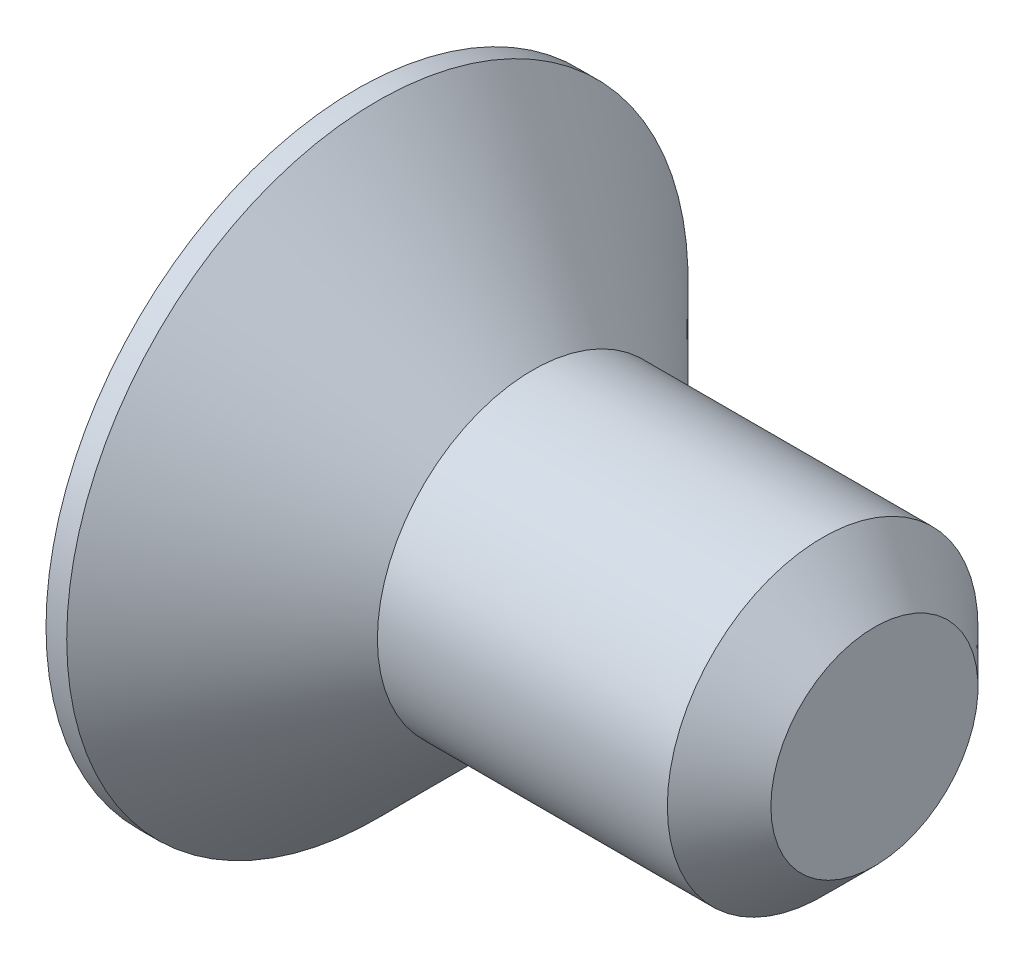
from build123d import *

# Parameters (mm, degrees)
CUT_EXTRUDE1_DEPTH = 1.1


with BuildPart() as part:
    # Sketch1 → Revolve1 (revolve)
    with BuildSketch(Plane.XY, mode=Mode.PRIVATE) as revolve1_sk:
        Polygon((0, -1.5), (2.8, -1.5), (3.3, -1), (3.3, 0), (-1.7, 0), (-1.7, -3), (-1.5, -3), align=None)
    revolve(revolve1_sk.sketch.rotate(Axis((-1.7, 0, 0), (1, 0, 0)), 270), axis=Axis((-1.7, 0, 0), (1, 0, 0)))

    # Sketch2 → Cut-Extrude1 (cut)
    with BuildSketch(Plane.ZY.offset(1.7)):
        Polygon((0, 1.154700538), (-1, 0.577350269), (-1, -0.577350269), (0, -1.154700538), (1, -0.577350269), (1, 0.577350269), align=None)
    extrude(amount=-CUT_EXTRUDE1_DEPTH, mode=Mode.SUBTRACT)


solid = part.part
